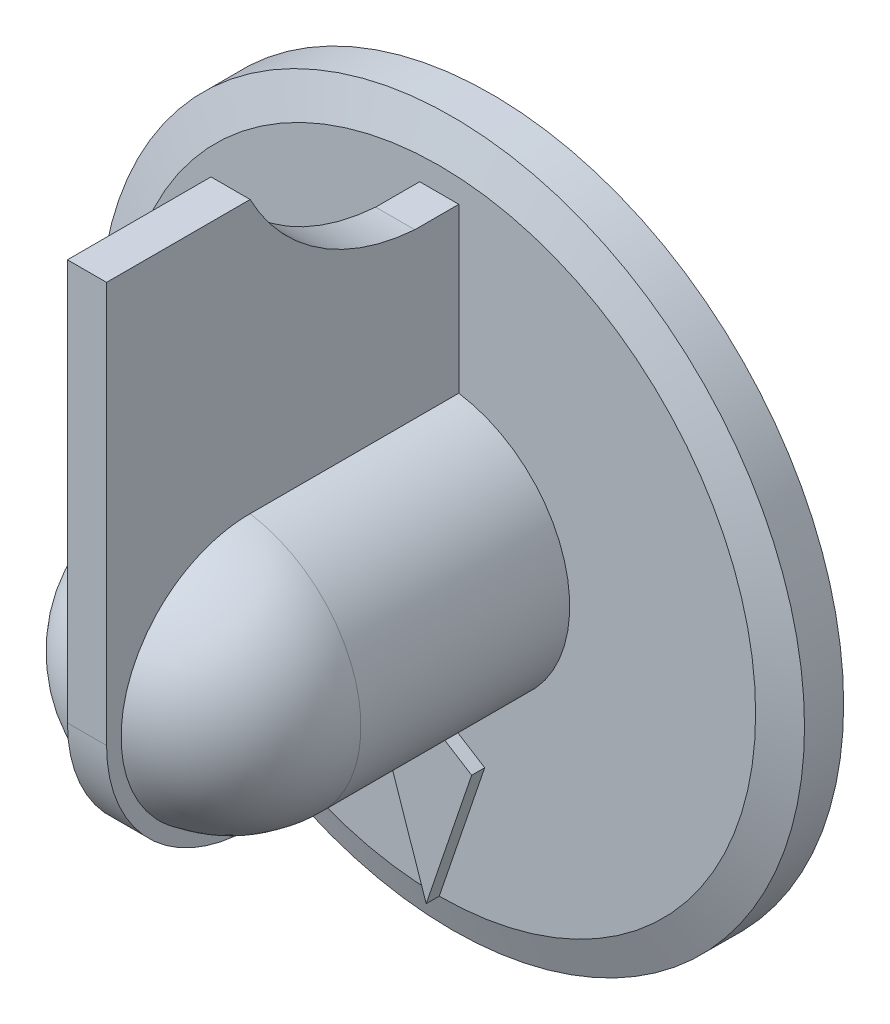
from build123d import *

# Parameters (mm, degrees)
SKETCH1_R           = 13.5
BOSS_EXTRUDE1_DEPTH = 2
CHAMFER1_SIZE       = 0.5
CHAMFER1_SIZE2      = 1.37373871
SKETCH2_R           = 5
BOSS_EXTRUDE2_DEPTH = 8
BOSS_EXTRUDE3_DEPTH = 0.75
CUT_EXTRUDE1_DEPTH  = 9.5
BOSS_EXTRUDE4_DEPTH = 0.5
SKETCH14_R          = 3.3
CUT_EXTRUDE5_DEPTH  = 0.6
FILLET1_R           = 0.1
FILLET2_R           = 0.5


with BuildPart() as part:
    # Sketch1 → Boss-Extrude1 (new body)
    with BuildSketch(Plane.XY):
        Circle(SKETCH1_R)
    extrude(amount=BOSS_EXTRUDE1_DEPTH)

    # Chamfer1
    chamfer1_edges = [part.edges().sort_by_distance(p)[0] for p in [
        (-13.5, 0, 2),
    ]]
    chamfer1_side = [part.faces().sort_by_distance(p)[0] for p in [
        (-13.5, 0, 1),
    ]]
    chamfer(chamfer1_edges, length=CHAMFER1_SIZE, length2=CHAMFER1_SIZE2, reference=chamfer1_side[0])

    # Sketch2 → Boss-Extrude2 (add)
    with BuildSketch(Plane.XY.offset(2)):
        Circle(SKETCH2_R)
    extrude(amount=BOSS_EXTRUDE2_DEPTH)

    # Sketch3 → Revolve6 (revolve)
    with BuildSketch(Plane.XY.offset(10)):
        with BuildLine():
            Line((0, 5), (0, -5))
            ThreePointArc((0, -5), (-5, 0), (0, 5))
        make_face()
    revolve(axis=Axis((0, 5, 10), (0, -1, 0)))

    # Sketch4 → Boss-Extrude3 (add, symmetric)
    with BuildSketch(Plane(origin=(0, 0, 0), x_dir=(0, 0, -1), z_dir=(1, 0, 0))):
        with BuildLine():
            Line((-10, -5.5), (-2, -5.5))
            Line((-2, -5.5), (-2, 11.212928284))
            Line((-2, 11.212928284), (-3.685714781, 11.212928284))
            ThreePointArc((-3.685714781, 11.212928284), (-7.384608105, 12.468225525), (-9.997477561, 15.371757202))
            Line((-9.997477561, 15.371757202), (-15.5, 15.371757202))
            Line((-15.5, 15.371757202), (-15.5, 0))
            ThreePointArc((-15.5, 0), (-13.889087297, -3.889087297), (-10, -5.5))
        make_face()
    extrude(amount=BOSS_EXTRUDE3_DEPTH, both=True)

    # Sketch6 → Cut-Extrude1 (cut)
    with BuildSketch(Plane(origin=(0, 0, 0), x_dir=(-1, 0, 0), z_dir=(0, 0, -1))):
        with BuildLine():
            ThreePointArc((-1.941278917, 1.947802907), (-2.106622219, 1.767665927), (-2.255310951, 1.573554103))
            ThreePointArc((-2.255310951, 1.573554103), (-2.663028117, 1.5375), (-2.490393303, 1.166379525))
            ThreePointArc((-2.490393303, 1.166379525), (-2.584154707, 0.940555394), (-2.657486258, 0.707295405))
            ThreePointArc((-2.657486258, 0.707295405), (-3.028283841, 0.533968146), (-2.739129502, 0.244273558))
            ThreePointArc((-2.739129502, 0.244273558), (-2.75, 0), (-2.739129502, -0.244273558))
            ThreePointArc((-2.739129502, -0.244273558), (-3.028283841, -0.533968146), (-2.657486258, -0.707295405))
            ThreePointArc((-2.657486258, -0.707295405), (-2.584154707, -0.940555394), (-2.490393303, -1.166379525))
            ThreePointArc((-2.490393303, -1.166379525), (-2.663028117, -1.5375), (-2.255310951, -1.573554103))
            ThreePointArc((-2.255310951, -1.573554103), (-2.106622219, -1.767665927), (-1.941278917, -1.947802907))
            ThreePointArc((-1.941278917, -1.947802907), (-1.9765719, -2.355586663), (-1.581111858, -2.250018954))
            ThreePointArc((-1.581111858, -2.250018954), (-1.375, -2.38156986), (-1.158017644, -2.494292512))
            ThreePointArc((-1.158017644, -2.494292512), (-1.051711941, -2.889554809), (-0.71620734, -2.655098312))
            ThreePointArc((-0.71620734, -2.655098312), (-0.477532489, -2.708221321), (-0.235082352, -2.739933628))
            ThreePointArc((-0.235082352, -2.739933628), (0, -3.075), (0.235082352, -2.739933628))
            ThreePointArc((0.235082352, -2.739933628), (0.477532489, -2.708221321), (0.71620734, -2.655098312))
            ThreePointArc((0.71620734, -2.655098312), (1.051711941, -2.889554809), (1.158017644, -2.494292512))
            ThreePointArc((1.158017644, -2.494292512), (1.375, -2.38156986), (1.581111858, -2.250018954))
            ThreePointArc((1.581111858, -2.250018954), (1.9765719, -2.355586663), (1.941278917, -1.947802907))
            ThreePointArc((1.941278917, -1.947802907), (2.106622219, -1.767665927), (2.255310951, -1.573554103))
            ThreePointArc((2.255310951, -1.573554103), (2.663028117, -1.5375), (2.490393303, -1.166379525))
            ThreePointArc((2.490393303, -1.166379525), (2.584154707, -0.940555394), (2.657486258, -0.707295405))
            ThreePointArc((2.657486258, -0.707295405), (3.028283841, -0.533968146), (2.739129502, -0.244273558))
            ThreePointArc((2.739129502, -0.244273558), (2.75, 0), (2.739129502, 0.244273558))
            ThreePointArc((2.739129502, 0.244273558), (3.028283841, 0.533968146), (2.657486258, 0.707295405))
            ThreePointArc((2.657486258, 0.707295405), (2.584154707, 0.940555394), (2.490393303, 1.166379525))
            ThreePointArc((2.490393303, 1.166379525), (2.663028117, 1.5375), (2.255310951, 1.573554103))
            ThreePointArc((2.255310951, 1.573554103), (2.106622219, 1.767665927), (1.941278917, 1.947802907))
            ThreePointArc((1.941278917, 1.947802907), (1.9765719, 2.355586663), (1.581111858, 2.250018954))
            ThreePointArc((1.581111858, 2.250018954), (1.375, 2.38156986), (1.158017644, 2.494292512))
            ThreePointArc((1.158017644, 2.494292512), (1.051711941, 2.889554809), (0.71620734, 2.655098312))
            ThreePointArc((0.71620734, 2.655098312), (0.477532489, 2.708221321), (0.235082352, 2.739933628))
            ThreePointArc((0.235082352, 2.739933628), (0, 3.075), (-0.235082352, 2.739933628))
            ThreePointArc((-0.235082352, 2.739933628), (-0.477532489, 2.708221321), (-0.71620734, 2.655098312))
            ThreePointArc((-0.71620734, 2.655098312), (-1.051711941, 2.889554809), (-1.158017644, 2.494292512))
            ThreePointArc((-1.158017644, 2.494292512), (-1.375, 2.38156986), (-1.581111858, 2.250018954))
            ThreePointArc((-1.581111858, 2.250018954), (-1.9765719, 2.355586663), (-1.941278917, 1.947802907))
        make_face()
    extrude(amount=-CUT_EXTRUDE1_DEPTH, mode=Mode.SUBTRACT)

    # Sketch7 → Boss-Extrude4 (add, symmetric)
    with BuildSketch(Plane.XY.offset(2)):
        Polygon((0, -5.898986052), (-1.742247572, -6.991141246), (0, -12.12626129), (1.742247572, -6.991141246), align=None)
    extrude(amount=BOSS_EXTRUDE4_DEPTH, both=True)

    # Sketch14 → Cut-Extrude5 (cut)
    with BuildSketch(Plane(origin=(0, 0, 0), x_dir=(-1, 0, 0), z_dir=(0, 0, -1))):
        Circle(SKETCH14_R)
    extrude(amount=-CUT_EXTRUDE5_DEPTH, mode=Mode.SUBTRACT)

    # Fillet1
    fillet1_edges = [part.edges().sort_by_distance(p)[0] for p in [
        (2.106622219, 1.767665927, 0.6),
        (1.9765719, 2.355586663, 0.6),
        (1.375, 2.38156986, 0.6),
        (1.051711941, 2.889554809, 0.6),
        (0.477532489, 2.708221321, 0.6),
        (0, 3.075, 0.6),
        (-0.477532489, 2.708221321, 0.6),
        (-1.051711941, 2.889554809, 0.6),
        (-1.375, 2.38156986, 0.6),
        (-1.9765719, 2.355586663, 0.6),
        (-2.106622219, 1.767665927, 0.6),
        (-2.663028117, 1.5375, 0.6),
        (-2.584154707, 0.940555394, 0.6),
        (-3.028283841, 0.533968146, 0.6),
        (-2.75, 0, 0.6),
        (-3.028283841, -0.533968146, 0.6),
        (-2.584154707, -0.940555394, 0.6),
        (-2.663028117, -1.5375, 0.6),
        (-2.106622219, -1.767665927, 0.6),
        (-1.9765719, -2.355586663, 0.6),
        (-1.375, -2.38156986, 0.6),
        (-1.051711941, -2.889554809, 0.6),
        (-0.477532489, -2.708221321, 0.6),
        (0, -3.075, 0.6),
        (0.477532489, -2.708221321, 0.6),
        (1.051711941, -2.889554809, 0.6),
        (1.375, -2.38156986, 0.6),
        (1.9765719, -2.355586663, 0.6),
        (2.106622219, -1.767665927, 0.6),
        (2.663028117, -1.5375, 0.6),
        (2.584154707, -0.940555394, 0.6),
        (3.028283841, -0.533968146, 0.6),
        (2.75, 0, 0.6),
        (3.028283841, 0.533968146, 0.6),
        (2.584154707, 0.940555394, 0.6),
        (2.663028117, 1.5375, 0.6),
        (1.9765719, 2.355586663, 9.5),
        (1.941278917, 1.947802907, 5.05),
        (1.375, 2.38156986, 9.5),
        (1.581111858, 2.250018954, 5.05),
        (1.051711941, 2.889554809, 9.5),
        (1.158017644, 2.494292512, 5.05),
        (0.477532489, 2.708221321, 9.5),
        (0.71620734, 2.655098312, 5.05),
        (0, 3.075, 9.5),
        (0.235082352, 2.739933628, 5.05),
        (-0.477532489, 2.708221321, 9.5),
        (-0.235082352, 2.739933628, 5.05),
        (-1.051711941, 2.889554809, 9.5),
        (-0.71620734, 2.655098312, 5.05),
        (-1.375, 2.38156986, 9.5),
        (-1.158017644, 2.494292512, 5.05),
        (-1.9765719, 2.355586663, 9.5),
        (-1.581111858, 2.250018954, 5.05),
        (-2.106622219, 1.767665927, 9.5),
        (-1.941278917, 1.947802907, 5.05),
        (-2.663028117, 1.5375, 9.5),
        (-2.255310951, 1.573554103, 5.05),
        (-2.584154707, 0.940555394, 9.5),
        (-2.490393303, 1.166379525, 5.05),
        (-3.028283841, 0.533968146, 9.5),
        (-2.657486258, 0.707295405, 5.05),
        (-2.75, 0, 9.5),
        (-2.739129502, 0.244273558, 5.05),
        (-3.028283841, -0.533968146, 9.5),
        (-2.739129502, -0.244273558, 5.05),
        (-2.584154707, -0.940555394, 9.5),
        (-2.657486258, -0.707295405, 5.05),
        (-2.663028117, -1.5375, 9.5),
        (-2.490393303, -1.166379525, 5.05),
        (-2.106622219, -1.767665927, 9.5),
        (-2.255310951, -1.573554103, 5.05),
        (-1.9765719, -2.355586663, 9.5),
        (-1.941278917, -1.947802907, 5.05),
        (-1.375, -2.38156986, 9.5),
        (-1.581111858, -2.250018954, 5.05),
        (-1.051711941, -2.889554809, 9.5),
        (-1.158017644, -2.494292512, 5.05),
        (-0.477532489, -2.708221321, 9.5),
        (-0.71620734, -2.655098312, 5.05),
        (0, -3.075, 9.5),
        (-0.235082352, -2.739933628, 5.05),
        (0.477532489, -2.708221321, 9.5),
        (0.235082352, -2.739933628, 5.05),
        (1.051711941, -2.889554809, 9.5),
        (0.71620734, -2.655098312, 5.05),
        (1.375, -2.38156986, 9.5),
        (1.158017644, -2.494292512, 5.05),
        (1.9765719, -2.355586663, 9.5),
        (1.581111858, -2.250018954, 5.05),
        (2.106622219, -1.767665927, 9.5),
        (1.941278917, -1.947802907, 5.05),
        (2.663028117, -1.5375, 9.5),
        (2.255310951, -1.573554103, 5.05),
        (2.584154707, -0.940555394, 9.5),
        (2.490393303, -1.166379525, 5.05),
        (3.028283841, -0.533968146, 9.5),
        (2.657486258, -0.707295405, 5.05),
        (2.75, 0, 9.5),
        (2.739129502, -0.244273558, 5.05),
        (3.028283841, 0.533968146, 9.5),
        (2.739129502, 0.244273558, 5.05),
        (2.584154707, 0.940555394, 9.5),
        (2.657486258, 0.707295405, 5.05),
        (2.663028117, 1.5375, 9.5),
        (2.490393303, 1.166379525, 5.05),
        (2.106622219, 1.767665927, 9.5),
        (2.255310951, 1.573554103, 5.05),
    ]]
    fillet(fillet1_edges, radius=FILLET1_R)

    # Fillet2
    fillet2_edges = [part.edges().sort_by_distance(p)[0] for p in [
        (3.3, 0, 0),
    ]]
    fillet(fillet2_edges, radius=FILLET2_R)


solid = part.part
